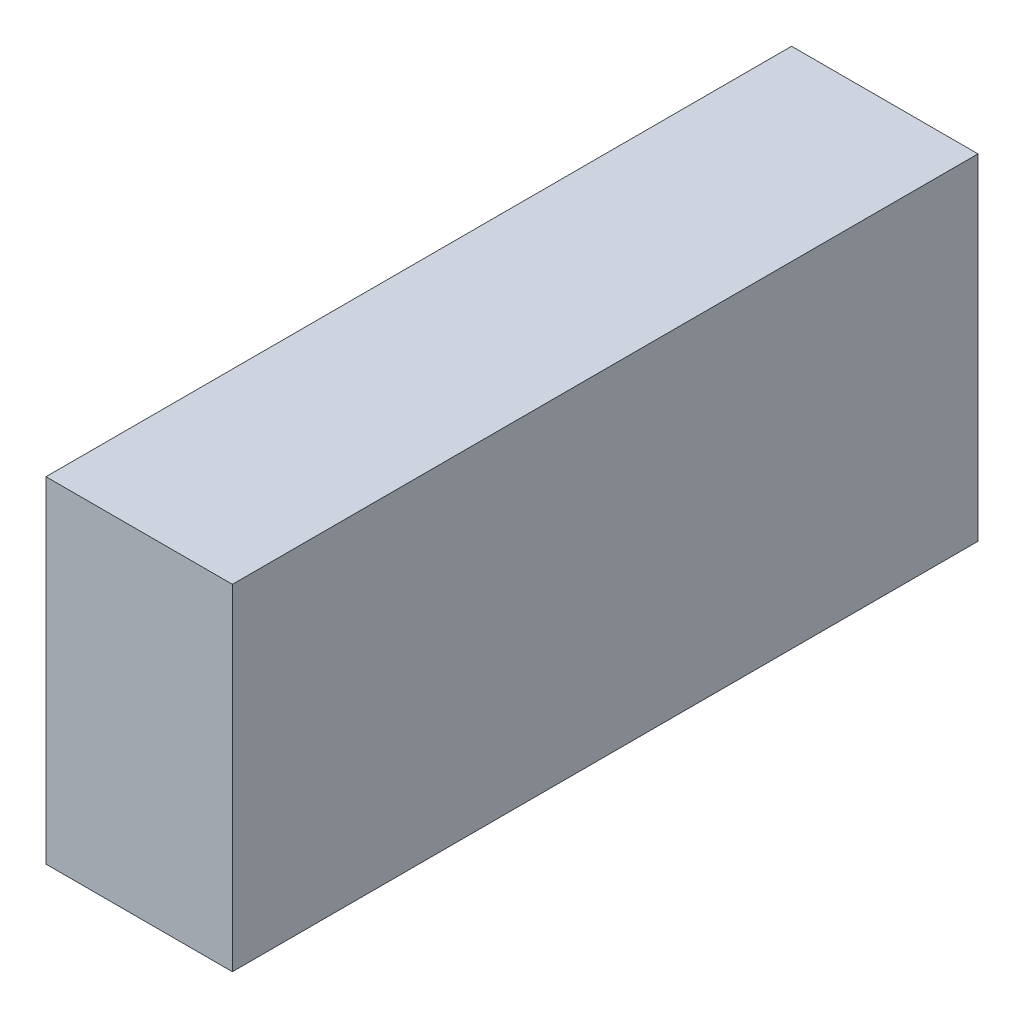
from build123d import *

# Parameters (mm, degrees)
ESBO_O1_W                = 50
ESBO_O1_H                = 90
RESSALTO_EXTRUS_O1_DEPTH = 200


with BuildPart() as part:
    # Esboço1 → Ressalto-extrusão1 (new body)
    with BuildSketch(Plane.XY):
        with Locations((25, 45)):
            Rectangle(ESBO_O1_W, ESBO_O1_H)
    extrude(amount=RESSALTO_EXTRUS_O1_DEPTH)


solid = part.part
